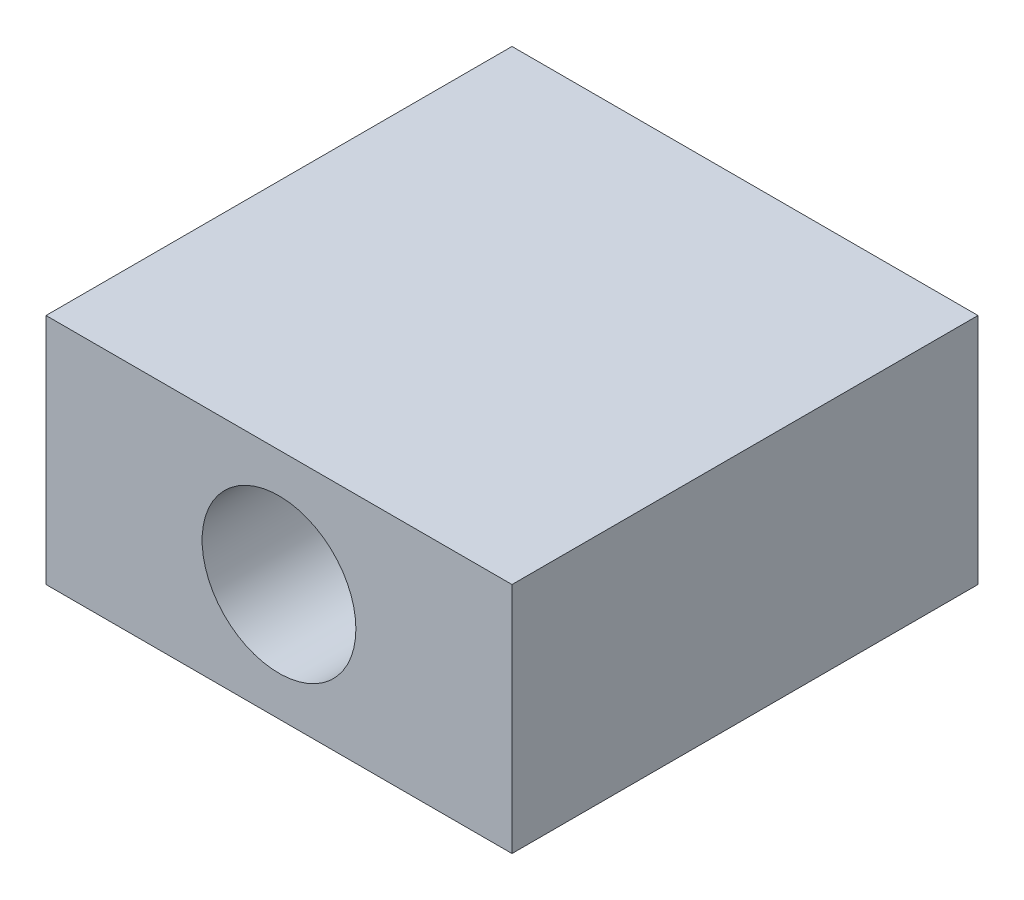
from build123d import *

# Parameters (mm, degrees)
SKETCH_1_W              = 20
SKETCH_1_H              = 10
SKETCH_1_R              = 3.3
END_STOP_20X10X20_DEPTH = 20


with BuildPart() as part:
    # 草图1 → End_stop_20x10x20 (new body)
    with BuildSketch(Plane.XY):
        with Locations((10, 5)):
            Rectangle(SKETCH_1_W, SKETCH_1_H)
        with Locations((10, 5)):
            Circle(SKETCH_1_R, mode=Mode.SUBTRACT)
    extrude(amount=END_STOP_20X10X20_DEPTH)


solid = part.part
